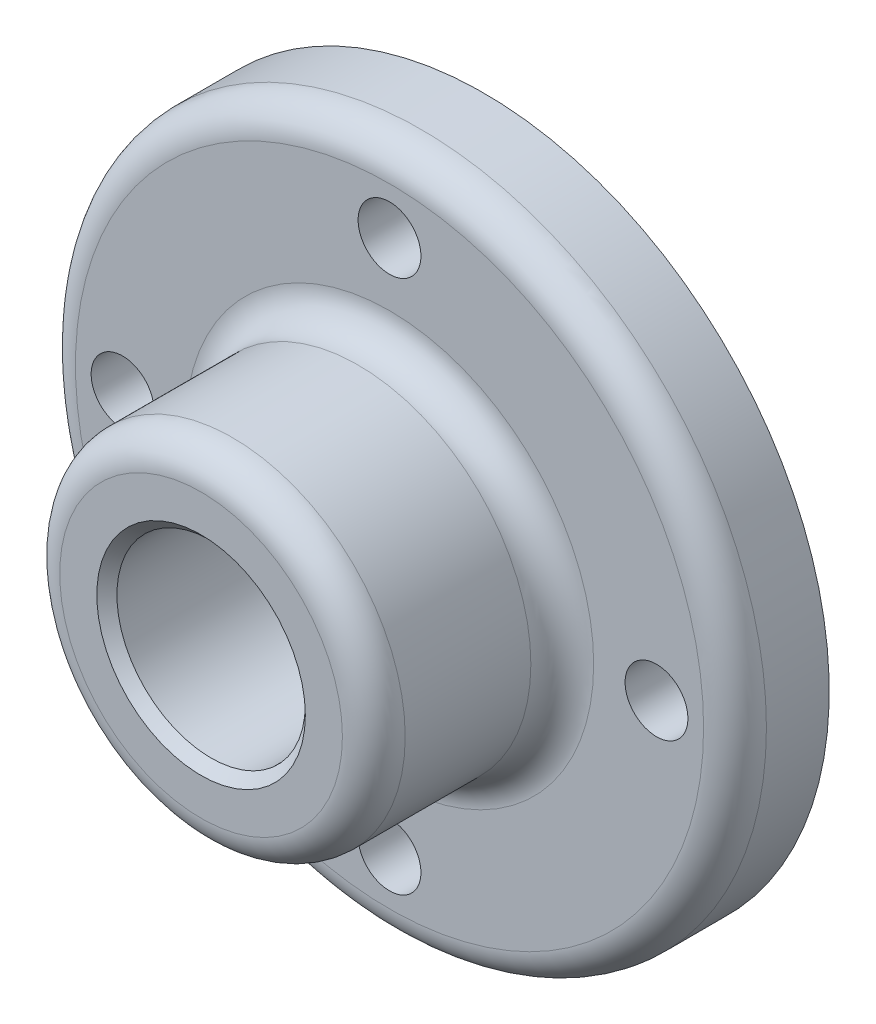
from build123d import *

# Parameters (mm, degrees)
SKETCH1_R           = 69.85
BOSS_EXTRUDE1_DEPTH = 19.05
BOSS_EXTRUDE2_REACH = 116.123
SKETCH2_R           = 34.925
SKETCH5_R           = 19.05
CUT_EXTRUDE1_DEPTH  = 115.123474798
SKETCH6_R           = 6.35
BOLT_HOLE_DEPTH     = 106.875658203
CIRPATTERN1_COUNT   = 4
FILLET1_R           = 6.35
CHAMFER1_SIZE       = 2.032


with BuildPart() as part:
    # Sketch1 → Boss-Extrude1 (new body)
    with BuildSketch(Plane.XY):
        with Locations(Location((0, 0, 0), (0, 0, 180))):
            Circle(SKETCH1_R)
    extrude(amount=BOSS_EXTRUDE1_DEPTH)

    # Sketch2 → Boss-Extrude2 (add, up to next)
    with BuildSketch(Plane.XY.offset(57.15), mode=Mode.PRIVATE) as boss_extrude2_sk1:
        Circle(SKETCH2_R)
    boss_extrude2_tool1 = extrude(boss_extrude2_sk1.sketch, amount=-BOSS_EXTRUDE2_REACH, mode=Mode.PRIVATE) - part.part
    add(boss_extrude2_tool1.solids().sort_by_distance((0, 0, 57.15))[0])

    # Sketch5 → Cut-Extrude1 (cut, through all)
    with BuildSketch(Plane.XY.offset(57.15)):
        Circle(SKETCH5_R)
    extrude(amount=-CUT_EXTRUDE1_DEPTH, mode=Mode.SUBTRACT)

    # Sketch6 → Bolt hole (cut, symmetric)
    with BuildSketch(Plane.XY.offset(19.05)):
        with Locations((0, 53.975)):
            Circle(SKETCH6_R)
    bolt_hole = extrude(amount=BOLT_HOLE_DEPTH, both=True, mode=Mode.SUBTRACT)

    # CirPattern1: Bolt hole ×4 about axis
    cirpattern1_axis = Axis((0, 0, 0), (0, 0, 1))
    for i in range(1, CIRPATTERN1_COUNT):
        add(bolt_hole.rotate(cirpattern1_axis, i * 360 / CIRPATTERN1_COUNT), mode=Mode.SUBTRACT)

    # Fillet1
    fillet1_edges = [part.edges().sort_by_distance(p)[0] for p in [
        (69.85, 0, 19.05),
        (-34.925, 0, 19.05),
        (-34.925, 0, 57.15),
    ]]
    fillet(fillet1_edges, radius=FILLET1_R)

    # Chamfer1
    chamfer1_edges = [part.edges().sort_by_distance(p)[0] for p in [
        (-19.05, 0, 57.15),
    ]]
    chamfer(chamfer1_edges, length=CHAMFER1_SIZE)


solid = part.part
